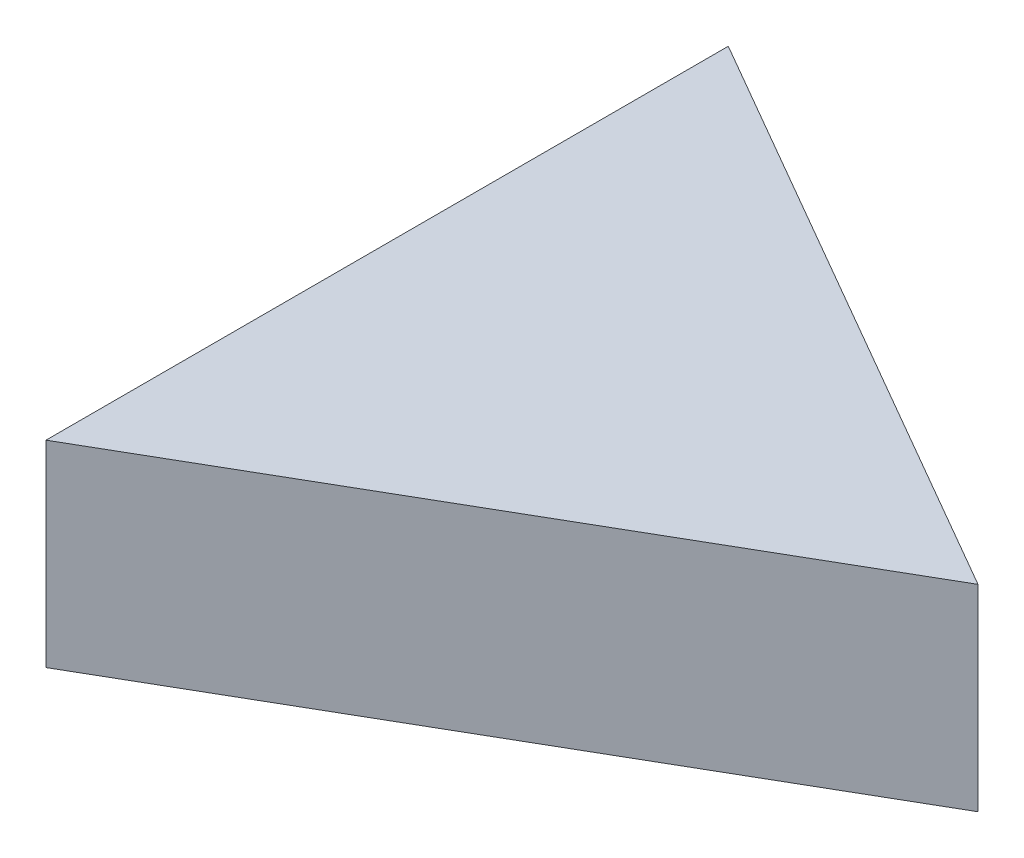
from build123d import *

# Parameters (mm, degrees)
BOSS_EXTRUDE1_DEPTH = 20


with BuildPart() as part:
    # Sketch1 → Boss-Extrude1 (new body)
    with BuildSketch(Plane(origin=(0, 0, 0), x_dir=(1, 0, 0), z_dir=(0, 1, 0))):
        Polygon((40, 0), (-20, 34.641016151), (-20, -34.641016151), align=None)
    extrude(amount=BOSS_EXTRUDE1_DEPTH)


solid = part.part
